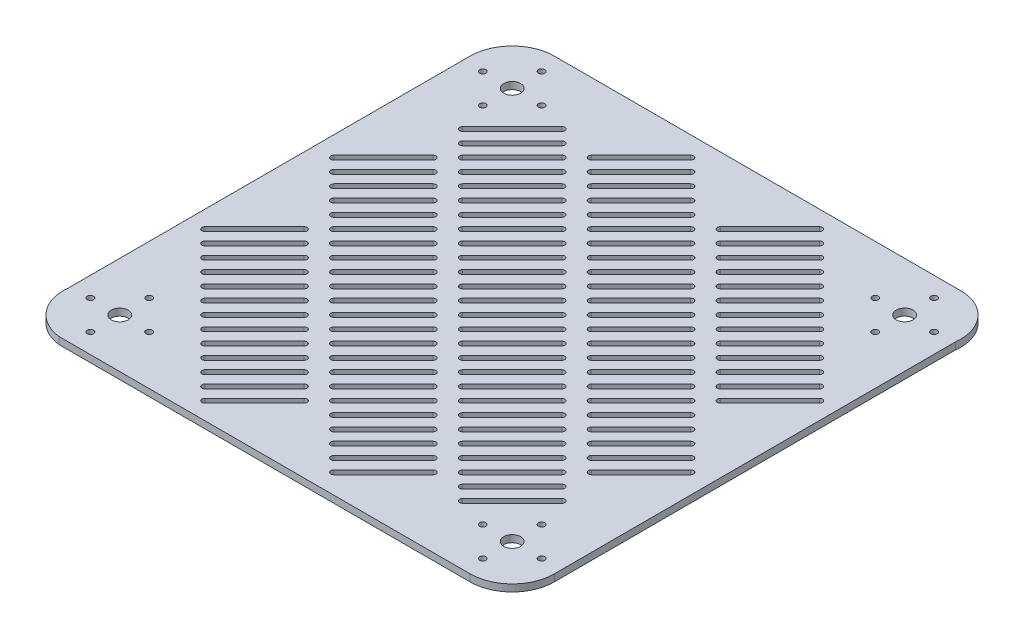
from build123d import *

# Parameters (mm, degrees)
SKETCH_5_R      = 2.25
SKETCH_5_R_2    = 6.02
EXTRUDE_2_DEPTH = 5


with BuildPart() as part:
    # 草图5 → 凸台-拉伸2 (new body)
    with BuildSketch(Plane(origin=(0, 0, 0), x_dir=(1, 0, 0), z_dir=(0, 1, 0))):
        with BuildLine():
            Line((-145, 175.000139282), (144.999922622, 175.000139282))
            ThreePointArc((144.999922622, 175.000139282), (167.429032222, 164.92347758), (174.790880658, 141.462717658))
            Line((174.790880658, 141.462717658), (175.000123274, -144.97808516))
            ThreePointArc((175.000123274, -144.97808516), (166.221042914, -166.205546782), (145, -175.000139282))
            Line((145, -175.000139282), (-148.46080939, -175.000139282))
            ThreePointArc((-148.46080939, -175.000139282), (-168.660495762, -163.766062757), (-175.000139282, -141.539035853))
            Line((-175.000139282, -141.539035853), (-175.000139282, 145))
            ThreePointArc((-175.000139282, 145), (-166.213301923, 166.213301923), (-145, 175.000139282))
        make_face()
        with Locations(Location((140, 119, 0), (0, 0, 270))):
            Circle(SKETCH_5_R, mode=Mode.SUBTRACT)
        with Locations(Location((161, 140, 0), (0, 0, 270))):
            Circle(SKETCH_5_R, mode=Mode.SUBTRACT)
        with Locations(Location((140, 161, 0), (0, 0, 270))):
            Circle(SKETCH_5_R, mode=Mode.SUBTRACT)
        with Locations(Location((119, 140, 0), (0, 0, 270))):
            Circle(SKETCH_5_R, mode=Mode.SUBTRACT)
        with Locations(Location((140, 140, 0), (0, 0, 270))):
            Circle(SKETCH_5_R_2, mode=Mode.SUBTRACT)
        with Locations(Location((140, -161, 0), (0, 0, 270))):
            Circle(SKETCH_5_R, mode=Mode.SUBTRACT)
        with Locations(Location((161, -140, 0), (0, 0, 270))):
            Circle(SKETCH_5_R, mode=Mode.SUBTRACT)
        with Locations(Location((140, -119, 0), (0, 0, 270))):
            Circle(SKETCH_5_R, mode=Mode.SUBTRACT)
        with Locations(Location((119, -140, 0), (0, 0, 270))):
            Circle(SKETCH_5_R, mode=Mode.SUBTRACT)
        with Locations(Location((140, -140, 0), (0, 0, 270))):
            Circle(SKETCH_5_R_2, mode=Mode.SUBTRACT)
        with Locations(Location((-140, 119, 0), (0, 0, 270))):
            Circle(SKETCH_5_R, mode=Mode.SUBTRACT)
        with Locations(Location((-119, 140, 0), (0, 0, 270))):
            Circle(SKETCH_5_R, mode=Mode.SUBTRACT)
        with Locations(Location((-140, 161, 0), (0, 0, 270))):
            Circle(SKETCH_5_R, mode=Mode.SUBTRACT)
        with Locations(Location((-161, 140, 0), (0, 0, 270))):
            Circle(SKETCH_5_R, mode=Mode.SUBTRACT)
        with Locations(Location((-140, 140, 0), (0, 0, 270))):
            Circle(SKETCH_5_R_2, mode=Mode.SUBTRACT)
        with Locations(Location((-140, -161, 0), (0, 0, 270))):
            Circle(SKETCH_5_R, mode=Mode.SUBTRACT)
        with Locations(Location((-119, -140.040540979, 0), (0, 0, 270))):
            Circle(SKETCH_5_R, mode=Mode.SUBTRACT)
        with Locations(Location((-140, -119, 0), (0, 0, 270))):
            Circle(SKETCH_5_R, mode=Mode.SUBTRACT)
        with Locations(Location((-161, -139.999994927, 0), (0, 0, 270))):
            Circle(SKETCH_5_R, mode=Mode.SUBTRACT)
        with Locations(Location((-140, -140.040540979, 0), (0, 0, 270))):
            Circle(SKETCH_5_R_2, mode=Mode.SUBTRACT)
        with BuildLine():
            Line((-28.041433375, -7.313905684), (7.313905684, 28.041433375))
            ThreePointArc((7.313905684, 28.041433375), (10.363763845, 28.041433375), (10.363763845, 24.991575214))
            Line((10.363763845, 24.991575214), (-24.991575214, -10.363763845))
            ThreePointArc((-24.991575214, -10.363763845), (-28.041433375, -10.363763845), (-28.041433375, -7.313905684))
        make_face(mode=Mode.SUBTRACT)
        with BuildLine():
            Line((-36.88026814, 1.524929081), (-1.524929081, 36.88026814))
            ThreePointArc((-1.524929081, 36.88026814), (1.524929081, 36.88026814), (1.524929081, 33.830409979))
            Line((1.524929081, 33.830409979), (-33.830409979, -1.524929081))
            ThreePointArc((-33.830409979, -1.524929081), (-36.88026814, -1.524929081), (-36.88026814, 1.524929081))
        make_face(mode=Mode.SUBTRACT)
        with BuildLine():
            Line((-45.719102905, 10.363763845), (-10.363763845, 45.719102905))
            ThreePointArc((-10.363763845, 45.719102905), (-7.313905684, 45.719102905), (-7.313905684, 42.669244744))
            Line((-7.313905684, 42.669244744), (-42.669244744, 7.313905684))
            ThreePointArc((-42.669244744, 7.313905684), (-45.719102905, 7.313905684), (-45.719102905, 10.363763845))
        make_face(mode=Mode.SUBTRACT)
        with BuildLine():
            Line((-54.55793767, 19.20259861), (-19.20259861, 54.55793767))
            ThreePointArc((-19.20259861, 54.55793767), (-16.152740449, 54.55793767), (-16.152740449, 51.508079508))
            Line((-16.152740449, 51.508079508), (-51.508079508, 16.152740449))
            ThreePointArc((-51.508079508, 16.152740449), (-54.55793767, 16.152740449), (-54.55793767, 19.20259861))
        make_face(mode=Mode.SUBTRACT)
        with BuildLine():
            Line((-63.396772434, 28.041433375), (-28.041433375, 63.396772434))
            ThreePointArc((-28.041433375, 63.396772434), (-24.991575214, 63.396772434), (-24.991575214, 60.346914273))
            Line((-24.991575214, 60.346914273), (-60.346914273, 24.991575214))
            ThreePointArc((-60.346914273, 24.991575214), (-63.396772434, 24.991575214), (-63.396772434, 28.041433375))
        make_face(mode=Mode.SUBTRACT)
        with BuildLine():
            Line((-72.235607199, 36.88026814), (-36.88026814, 72.235607199))
            ThreePointArc((-36.88026814, 72.235607199), (-33.830409979, 72.235607199), (-33.830409979, 69.185749038))
            Line((-33.830409979, 69.185749038), (-69.185749038, 33.830409979))
            ThreePointArc((-69.185749038, 33.830409979), (-72.235607199, 33.830409979), (-72.235607199, 36.88026814))
        make_face(mode=Mode.SUBTRACT)
        with BuildLine():
            Line((-81.074441964, 45.719102905), (-45.719102905, 81.074441964))
            ThreePointArc((-45.719102905, 81.074441964), (-42.669244744, 81.074441964), (-42.669244744, 78.024583803))
            Line((-42.669244744, 78.024583803), (-78.024583803, 42.669244744))
            ThreePointArc((-78.024583803, 42.669244744), (-81.074441964, 42.669244744), (-81.074441964, 45.719102905))
        make_face(mode=Mode.SUBTRACT)
        with BuildLine():
            Line((-19.20259861, -16.152740449), (16.152740449, 19.20259861))
            ThreePointArc((16.152740449, 19.20259861), (19.20259861, 19.20259861), (19.20259861, 16.152740449))
            Line((19.20259861, 16.152740449), (-16.152740449, -19.20259861))
            ThreePointArc((-16.152740449, -19.20259861), (-19.20259861, -19.20259861), (-19.20259861, -16.152740449))
        make_face(mode=Mode.SUBTRACT)
        with BuildLine():
            Line((-89.913276729, 54.55793767), (-54.55793767, 89.913276729))
            ThreePointArc((-54.55793767, 89.913276729), (-51.508079508, 89.913276729), (-51.508079508, 86.863418568))
            Line((-51.508079508, 86.863418568), (-86.863418568, 51.508079508))
            ThreePointArc((-86.863418568, 51.508079508), (-89.913276729, 51.508079508), (-89.913276729, 54.55793767))
        make_face(mode=Mode.SUBTRACT)
        with BuildLine():
            Line((-98.752111494, 63.396772434), (-63.396772434, 98.752111494))
            ThreePointArc((-63.396772434, 98.752111494), (-60.346914273, 98.752111494), (-60.346914273, 95.702253333))
            Line((-60.346914273, 95.702253333), (-95.702253333, 60.346914273))
            ThreePointArc((-95.702253333, 60.346914273), (-98.752111494, 60.346914273), (-98.752111494, 63.396772434))
        make_face(mode=Mode.SUBTRACT)
        with BuildLine():
            Line((-107.590946259, 72.235607199), (-72.235607199, 107.590946259))
            ThreePointArc((-72.235607199, 107.590946259), (-69.185749038, 107.590946259), (-69.185749038, 104.541088097))
            Line((-69.185749038, 104.541088097), (-104.541088097, 69.185749038))
            ThreePointArc((-104.541088097, 69.185749038), (-107.590946259, 69.185749038), (-107.590946259, 72.235607199))
        make_face(mode=Mode.SUBTRACT)
        with BuildLine():
            Line((-116.429781023, 81.074441964), (-81.074441964, 116.429781023))
            ThreePointArc((-81.074441964, 116.429781023), (-78.024583803, 116.429781023), (-78.024583803, 113.379922862))
            Line((-78.024583803, 113.379922862), (-113.379922862, 78.024583803))
            ThreePointArc((-113.379922862, 78.024583803), (-116.429781023, 78.024583803), (-116.429781023, 81.074441964))
        make_face(mode=Mode.SUBTRACT)
        with BuildLine():
            Line((-125.268615788, 89.913276729), (-89.913276729, 125.268615788))
            ThreePointArc((-89.913276729, 125.268615788), (-86.863418568, 125.268615788), (-86.863418568, 122.218757627))
            Line((-86.863418568, 122.218757627), (-122.218757627, 86.863418568))
            ThreePointArc((-122.218757627, 86.863418568), (-125.268615788, 86.863418568), (-125.268615788, 89.913276729))
        make_face(mode=Mode.SUBTRACT)
        with BuildLine():
            Line((-134.107450553, 98.752111494), (-98.752111494, 134.107450553))
            ThreePointArc((-98.752111494, 134.107450553), (-95.702253333, 134.107450553), (-95.702253333, 131.057592392))
            Line((-95.702253333, 131.057592392), (-131.057592392, 95.702253333))
            ThreePointArc((-131.057592392, 95.702253333), (-134.107450553, 95.702253333), (-134.107450553, 98.752111494))
        make_face(mode=Mode.SUBTRACT)
        with BuildLine():
            Line((-10.363763845, -24.991575214), (24.991575214, 10.363763845))
            ThreePointArc((24.991575214, 10.363763845), (28.041433375, 10.363763845), (28.041433375, 7.313905684))
            Line((28.041433375, 7.313905684), (-7.313905684, -28.041433375))
            ThreePointArc((-7.313905684, -28.041433375), (-10.363763845, -28.041433375), (-10.363763845, -24.991575214))
        make_face(mode=Mode.SUBTRACT)
        with BuildLine():
            Line((-1.524929081, -33.830409979), (33.830409979, 1.524929081))
            ThreePointArc((33.830409979, 1.524929081), (36.88026814, 1.524929081), (36.88026814, -1.524929081))
            Line((36.88026814, -1.524929081), (1.524929081, -36.88026814))
            ThreePointArc((1.524929081, -36.88026814), (-1.524929081, -36.88026814), (-1.524929081, -33.830409979))
        make_face(mode=Mode.SUBTRACT)
        with BuildLine():
            Line((7.313905684, -42.669244744), (42.669244744, -7.313905684))
            ThreePointArc((42.669244744, -7.313905684), (45.719102905, -7.313905684), (45.719102905, -10.363763845))
            Line((45.719102905, -10.363763845), (10.363763845, -45.719102905))
            ThreePointArc((10.363763845, -45.719102905), (7.313905684, -45.719102905), (7.313905684, -42.669244744))
        make_face(mode=Mode.SUBTRACT)
        with BuildLine():
            Line((16.152740449, -51.508079508), (51.508079508, -16.152740449))
            ThreePointArc((51.508079508, -16.152740449), (54.55793767, -16.152740449), (54.55793767, -19.20259861))
            Line((54.55793767, -19.20259861), (19.20259861, -54.55793767))
            ThreePointArc((19.20259861, -54.55793767), (16.152740449, -54.55793767), (16.152740449, -51.508079508))
        make_face(mode=Mode.SUBTRACT)
        with BuildLine():
            Line((24.991575214, -60.346914273), (60.346914273, -24.991575214))
            ThreePointArc((60.346914273, -24.991575214), (63.396772434, -24.991575214), (63.396772434, -28.041433375))
            Line((63.396772434, -28.041433375), (28.041433375, -63.396772434))
            ThreePointArc((28.041433375, -63.396772434), (24.991575214, -63.396772434), (24.991575214, -60.346914273))
        make_face(mode=Mode.SUBTRACT)
        with BuildLine():
            Line((33.830409979, -69.185749038), (69.185749038, -33.830409979))
            ThreePointArc((69.185749038, -33.830409979), (72.235607199, -33.830409979), (72.235607199, -36.88026814))
            Line((72.235607199, -36.88026814), (36.88026814, -72.235607199))
            ThreePointArc((36.88026814, -72.235607199), (33.830409979, -72.235607199), (33.830409979, -69.185749038))
        make_face(mode=Mode.SUBTRACT)
        with BuildLine():
            Line((42.669244744, -78.024583803), (78.024583803, -42.669244744))
            ThreePointArc((78.024583803, -42.669244744), (81.074441964, -42.669244744), (81.074441964, -45.719102905))
            Line((81.074441964, -45.719102905), (45.719102905, -81.074441964))
            ThreePointArc((45.719102905, -81.074441964), (42.669244744, -81.074441964), (42.669244744, -78.024583803))
        make_face(mode=Mode.SUBTRACT)
        with BuildLine():
            Line((51.508079508, -86.863418568), (86.863418568, -51.508079508))
            ThreePointArc((86.863418568, -51.508079508), (89.913276729, -51.508079508), (89.913276729, -54.55793767))
            Line((89.913276729, -54.55793767), (54.55793767, -89.913276729))
            ThreePointArc((54.55793767, -89.913276729), (51.508079508, -89.913276729), (51.508079508, -86.863418568))
        make_face(mode=Mode.SUBTRACT)
        with BuildLine():
            Line((60.346914273, -95.702253333), (95.702253333, -60.346914273))
            ThreePointArc((95.702253333, -60.346914273), (98.752111494, -60.346914273), (98.752111494, -63.396772434))
            Line((98.752111494, -63.396772434), (63.396772434, -98.752111494))
            ThreePointArc((63.396772434, -98.752111494), (60.346914273, -98.752111494), (60.346914273, -95.702253333))
        make_face(mode=Mode.SUBTRACT)
        with BuildLine():
            Line((69.185749038, -104.541088097), (104.541088097, -69.185749038))
            ThreePointArc((104.541088097, -69.185749038), (107.590946259, -69.185749038), (107.590946259, -72.235607199))
            Line((107.590946259, -72.235607199), (72.235607199, -107.590946259))
            ThreePointArc((72.235607199, -107.590946259), (69.185749038, -107.590946259), (69.185749038, -104.541088097))
        make_face(mode=Mode.SUBTRACT)
        with BuildLine():
            Line((78.024583803, -113.379922862), (113.379922862, -78.024583803))
            ThreePointArc((113.379922862, -78.024583803), (116.429781023, -78.024583803), (116.429781023, -81.074441964))
            Line((116.429781023, -81.074441964), (81.074441964, -116.429781023))
            ThreePointArc((81.074441964, -116.429781023), (78.024583803, -116.429781023), (78.024583803, -113.379922862))
        make_face(mode=Mode.SUBTRACT)
        with BuildLine():
            Line((86.863418568, -122.218757627), (122.218757627, -86.863418568))
            ThreePointArc((122.218757627, -86.863418568), (125.268615788, -86.863418568), (125.268615788, -89.913276729))
            Line((125.268615788, -89.913276729), (89.913276729, -125.268615788))
            ThreePointArc((89.913276729, -125.268615788), (86.863418568, -125.268615788), (86.863418568, -122.218757627))
        make_face(mode=Mode.SUBTRACT)
        with BuildLine():
            Line((95.702253333, -131.057592392), (131.057592392, -95.702253333))
            ThreePointArc((131.057592392, -95.702253333), (134.107450553, -95.702253333), (134.107450553, -98.752111494))
            Line((134.107450553, -98.752111494), (98.752111494, -134.107450553))
            ThreePointArc((98.752111494, -134.107450553), (95.702253333, -134.107450553), (95.702253333, -131.057592392))
        make_face(mode=Mode.SUBTRACT)
        with BuildLine():
            Line((26.759342167, 29.809200328), (62.114681226, 65.164539387))
            ThreePointArc((62.114681226, 65.164539387), (65.164539387, 65.164539387), (65.164539387, 62.114681226))
            Line((65.164539387, 62.114681226), (29.809200328, 26.759342167))
            ThreePointArc((29.809200328, 26.759342167), (26.759342167, 26.759342167), (26.759342167, 29.809200328))
        make_face(mode=Mode.SUBTRACT)
        with BuildLine():
            Line((72.721282944, 75.771141105), (108.076622003, 111.126480165))
            ThreePointArc((108.076622003, 111.126480165), (111.126480165, 111.126480165), (111.126480165, 108.076622003))
            Line((111.126480165, 108.076622003), (75.771141105, 72.721282944))
            ThreePointArc((75.771141105, 72.721282944), (72.721282944, 72.721282944), (72.721282944, 75.771141105))
        make_face(mode=Mode.SUBTRACT)
        with BuildLine():
            Line((17.920507402, 38.648035093), (53.275846461, 74.003374152))
            ThreePointArc((53.275846461, 74.003374152), (56.325704623, 74.003374152), (56.325704623, 70.953515991))
            Line((56.325704623, 70.953515991), (20.970365563, 35.598176932))
            ThreePointArc((20.970365563, 35.598176932), (17.920507402, 35.598176932), (17.920507402, 38.648035093))
        make_face(mode=Mode.SUBTRACT)
        with BuildLine():
            Line((9.081672637, 47.486869858), (44.437011696, 82.842208917))
            ThreePointArc((44.437011696, 82.842208917), (47.486869858, 82.842208917), (47.486869858, 79.792350756))
            Line((47.486869858, 79.792350756), (12.131530798, 44.437011696))
            ThreePointArc((12.131530798, 44.437011696), (9.081672637, 44.437011696), (9.081672637, 47.486869858))
        make_face(mode=Mode.SUBTRACT)
        with BuildLine():
            Line((0.242837872, 56.325704623), (35.598176932, 91.681043682))
            ThreePointArc((35.598176932, 91.681043682), (38.648035093, 91.681043682), (38.648035093, 88.631185521))
            Line((38.648035093, 88.631185521), (3.292696034, 53.275846461))
            ThreePointArc((3.292696034, 53.275846461), (0.242837872, 53.275846461), (0.242837872, 56.325704623))
        make_face(mode=Mode.SUBTRACT)
        with BuildLine():
            Line((-8.595996893, 65.164539387), (26.759342167, 100.519878447))
            ThreePointArc((26.759342167, 100.519878447), (29.809200328, 100.519878447), (29.809200328, 97.470020285))
            Line((29.809200328, 97.470020285), (-5.546138731, 62.114681226))
            ThreePointArc((-5.546138731, 62.114681226), (-8.595996893, 62.114681226), (-8.595996893, 65.164539387))
        make_face(mode=Mode.SUBTRACT)
        with BuildLine():
            Line((-17.434831657, 74.003374152), (17.920507402, 109.358713212))
            ThreePointArc((17.920507402, 109.358713212), (20.970365563, 109.358713212), (20.970365563, 106.30885505))
            Line((20.970365563, 106.30885505), (-14.384973496, 70.953515991))
            ThreePointArc((-14.384973496, 70.953515991), (-17.434831657, 70.953515991), (-17.434831657, 74.003374152))
        make_face(mode=Mode.SUBTRACT)
        with BuildLine():
            Line((-26.273666422, 82.842208917), (9.081672637, 118.197547976))
            ThreePointArc((9.081672637, 118.197547976), (12.131530798, 118.197547976), (12.131530798, 115.147689815))
            Line((12.131530798, 115.147689815), (-23.223808261, 79.792350756))
            ThreePointArc((-23.223808261, 79.792350756), (-26.273666422, 79.792350756), (-26.273666422, 82.842208917))
        make_face(mode=Mode.SUBTRACT)
        with BuildLine():
            Line((-35.112501187, 91.681043682), (0.242837872, 127.036382741))
            ThreePointArc((0.242837872, 127.036382741), (3.292696034, 127.036382741), (3.292696034, 123.98652458))
            Line((3.292696034, 123.98652458), (-32.062643026, 88.631185521))
            ThreePointArc((-32.062643026, 88.631185521), (-35.112501187, 88.631185521), (-35.112501187, 91.681043682))
        make_face(mode=Mode.SUBTRACT)
        with BuildLine():
            Line((-43.951335952, 100.519878447), (-8.595996893, 135.875217506))
            ThreePointArc((-8.595996893, 135.875217506), (-5.546138731, 135.875217506), (-5.546138731, 132.825359345))
            Line((-5.546138731, 132.825359345), (-40.901477791, 97.470020285))
            ThreePointArc((-40.901477791, 97.470020285), (-43.951335952, 97.470020285), (-43.951335952, 100.519878447))
        make_face(mode=Mode.SUBTRACT)
        with BuildLine():
            Line((-52.790170717, 109.358713212), (-17.434831657, 144.714052271))
            ThreePointArc((-17.434831657, 144.714052271), (-14.384973496, 144.714052271), (-14.384973496, 141.66419411))
            Line((-14.384973496, 141.66419411), (-49.740312555, 106.30885505))
            ThreePointArc((-49.740312555, 106.30885505), (-52.790170717, 106.30885505), (-52.790170717, 109.358713212))
        make_face(mode=Mode.SUBTRACT)
        with BuildLine():
            Line((-61.629005481, 118.197547976), (-26.273666422, 153.552887036))
            ThreePointArc((-26.273666422, 153.552887036), (-23.223808261, 153.552887036), (-23.223808261, 150.503028874))
            Line((-23.223808261, 150.503028874), (-58.57914732, 115.147689815))
            ThreePointArc((-58.57914732, 115.147689815), (-61.629005481, 115.147689815), (-61.629005481, 118.197547976))
        make_face(mode=Mode.SUBTRACT)
        with BuildLine():
            Line((-70.467840246, 127.036382741), (-35.112501187, 162.391721801))
            ThreePointArc((-35.112501187, 162.391721801), (-32.062643026, 162.391721801), (-32.062643026, 159.341863639))
            Line((-32.062643026, 159.341863639), (-67.417982085, 123.98652458))
            ThreePointArc((-67.417982085, 123.98652458), (-70.467840246, 123.98652458), (-70.467840246, 127.036382741))
        make_face(mode=Mode.SUBTRACT)
        with BuildLine():
            Line((35.598176932, 20.970365563), (70.953515991, 56.325704623))
            ThreePointArc((70.953515991, 56.325704623), (74.003374152, 56.325704623), (74.003374152, 53.275846461))
            Line((74.003374152, 53.275846461), (38.648035093, 17.920507402))
            ThreePointArc((38.648035093, 17.920507402), (35.598176932, 17.920507402), (35.598176932, 20.970365563))
        make_face(mode=Mode.SUBTRACT)
        with BuildLine():
            Line((44.437011696, 12.131530798), (79.792350756, 47.486869858))
            ThreePointArc((79.792350756, 47.486869858), (82.842208917, 47.486869858), (82.842208917, 44.437011696))
            Line((82.842208917, 44.437011696), (47.486869858, 9.081672637))
            ThreePointArc((47.486869858, 9.081672637), (44.437011696, 9.081672637), (44.437011696, 12.131530798))
        make_face(mode=Mode.SUBTRACT)
        with BuildLine():
            Line((53.275846461, 3.292696034), (88.631185521, 38.648035093))
            ThreePointArc((88.631185521, 38.648035093), (91.681043682, 38.648035093), (91.681043682, 35.598176932))
            Line((91.681043682, 35.598176932), (56.325704623, 0.242837872))
            ThreePointArc((56.325704623, 0.242837872), (53.275846461, 0.242837872), (53.275846461, 3.292696034))
        make_face(mode=Mode.SUBTRACT)
        with BuildLine():
            Line((62.114681226, -5.546138731), (97.470020285, 29.809200328))
            ThreePointArc((97.470020285, 29.809200328), (100.519878447, 29.809200328), (100.519878447, 26.759342167))
            Line((100.519878447, 26.759342167), (65.164539387, -8.595996893))
            ThreePointArc((65.164539387, -8.595996893), (62.114681226, -8.595996893), (62.114681226, -5.546138731))
        make_face(mode=Mode.SUBTRACT)
        with BuildLine():
            Line((70.953515991, -14.384973496), (106.30885505, 20.970365563))
            ThreePointArc((106.30885505, 20.970365563), (109.358713212, 20.970365563), (109.358713212, 17.920507402))
            Line((109.358713212, 17.920507402), (74.003374152, -17.434831657))
            ThreePointArc((74.003374152, -17.434831657), (70.953515991, -17.434831657), (70.953515991, -14.384973496))
        make_face(mode=Mode.SUBTRACT)
        with BuildLine():
            Line((79.792350756, -23.223808261), (115.147689815, 12.131530798))
            ThreePointArc((115.147689815, 12.131530798), (118.197547976, 12.131530798), (118.197547976, 9.081672637))
            Line((118.197547976, 9.081672637), (82.842208917, -26.273666422))
            ThreePointArc((82.842208917, -26.273666422), (79.792350756, -26.273666422), (79.792350756, -23.223808261))
        make_face(mode=Mode.SUBTRACT)
        with BuildLine():
            Line((88.631185521, -32.062643026), (123.98652458, 3.292696034))
            ThreePointArc((123.98652458, 3.292696034), (127.036382741, 3.292696034), (127.036382741, 0.242837872))
            Line((127.036382741, 0.242837872), (91.681043682, -35.112501187))
            ThreePointArc((91.681043682, -35.112501187), (88.631185521, -35.112501187), (88.631185521, -32.062643026))
        make_face(mode=Mode.SUBTRACT)
        with BuildLine():
            Line((97.470020285, -40.901477791), (132.825359345, -5.546138731))
            ThreePointArc((132.825359345, -5.546138731), (135.875217506, -5.546138731), (135.875217506, -8.595996893))
            Line((135.875217506, -8.595996893), (100.519878447, -43.951335952))
            ThreePointArc((100.519878447, -43.951335952), (97.470020285, -43.951335952), (97.470020285, -40.901477791))
        make_face(mode=Mode.SUBTRACT)
        with BuildLine():
            Line((106.30885505, -49.740312555), (141.66419411, -14.384973496))
            ThreePointArc((141.66419411, -14.384973496), (144.714052271, -14.384973496), (144.714052271, -17.434831657))
            Line((144.714052271, -17.434831657), (109.358713212, -52.790170717))
            ThreePointArc((109.358713212, -52.790170717), (106.30885505, -52.790170717), (106.30885505, -49.740312555))
        make_face(mode=Mode.SUBTRACT)
        with BuildLine():
            Line((115.147689815, -58.57914732), (150.503028874, -23.223808261))
            ThreePointArc((150.503028874, -23.223808261), (153.552887036, -23.223808261), (153.552887036, -26.273666422))
            Line((153.552887036, -26.273666422), (118.197547976, -61.629005481))
            ThreePointArc((118.197547976, -61.629005481), (115.147689815, -61.629005481), (115.147689815, -58.57914732))
        make_face(mode=Mode.SUBTRACT)
        with BuildLine():
            Line((123.98652458, -67.417982085), (159.341863639, -32.062643026))
            ThreePointArc((159.341863639, -32.062643026), (162.391721801, -32.062643026), (162.391721801, -35.112501187))
            Line((162.391721801, -35.112501187), (127.036382741, -70.467840246))
            ThreePointArc((127.036382741, -70.467840246), (123.98652458, -70.467840246), (123.98652458, -67.417982085))
        make_face(mode=Mode.SUBTRACT)
        with BuildLine():
            Line((63.882448179, 84.60997587), (99.237787238, 119.965314929))
            ThreePointArc((99.237787238, 119.965314929), (102.2876454, 119.965314929), (102.2876454, 116.915456768))
            Line((102.2876454, 116.915456768), (66.93230634, 81.560117709))
            ThreePointArc((66.93230634, 81.560117709), (63.882448179, 81.560117709), (63.882448179, 84.60997587))
        make_face(mode=Mode.SUBTRACT)
        with BuildLine():
            Line((55.043613414, 93.448810635), (90.398952474, 128.804149694))
            ThreePointArc((90.398952474, 128.804149694), (93.448810635, 128.804149694), (93.448810635, 125.754291533))
            Line((93.448810635, 125.754291533), (58.093471576, 90.398952474))
            ThreePointArc((58.093471576, 90.398952474), (55.043613414, 90.398952474), (55.043613414, 93.448810635))
        make_face(mode=Mode.SUBTRACT)
        with BuildLine():
            Line((46.204778649, 102.2876454), (81.560117709, 137.642984459))
            ThreePointArc((81.560117709, 137.642984459), (84.60997587, 137.642984459), (84.60997587, 134.593126298))
            Line((84.60997587, 134.593126298), (49.254636811, 99.237787238))
            ThreePointArc((49.254636811, 99.237787238), (46.204778649, 99.237787238), (46.204778649, 102.2876454))
        make_face(mode=Mode.SUBTRACT)
        with BuildLine():
            Line((37.365943885, 111.126480165), (72.721282944, 146.481819224))
            ThreePointArc((72.721282944, 146.481819224), (75.771141105, 146.481819224), (75.771141105, 143.431961063))
            Line((75.771141105, 143.431961063), (40.415802046, 108.076622003))
            ThreePointArc((40.415802046, 108.076622003), (37.365943885, 108.076622003), (37.365943885, 111.126480165))
        make_face(mode=Mode.SUBTRACT)
        with BuildLine():
            Line((28.52710912, 119.965314929), (63.882448179, 155.320653989))
            ThreePointArc((63.882448179, 155.320653989), (66.93230634, 155.320653989), (66.93230634, 152.270795827))
            Line((66.93230634, 152.270795827), (31.576967281, 116.915456768))
            ThreePointArc((31.576967281, 116.915456768), (28.52710912, 116.915456768), (28.52710912, 119.965314929))
        make_face(mode=Mode.SUBTRACT)
        with BuildLine():
            Line((19.688274355, 128.804149694), (55.043613414, 164.159488754))
            ThreePointArc((55.043613414, 164.159488754), (58.093471576, 164.159488754), (58.093471576, 161.109630592))
            Line((58.093471576, 161.109630592), (22.738132516, 125.754291533))
            ThreePointArc((22.738132516, 125.754291533), (19.688274355, 125.754291533), (19.688274355, 128.804149694))
        make_face(mode=Mode.SUBTRACT)
        with BuildLine():
            Line((81.560117709, 66.93230634), (116.915456768, 102.2876454))
            ThreePointArc((116.915456768, 102.2876454), (119.965314929, 102.2876454), (119.965314929, 99.237787238))
            Line((119.965314929, 99.237787238), (84.60997587, 63.882448179))
            ThreePointArc((84.60997587, 63.882448179), (81.560117709, 63.882448179), (81.560117709, 66.93230634))
        make_face(mode=Mode.SUBTRACT)
        with BuildLine():
            Line((90.398952474, 58.093471576), (125.754291533, 93.448810635))
            ThreePointArc((125.754291533, 93.448810635), (128.804149694, 93.448810635), (128.804149694, 90.398952474))
            Line((128.804149694, 90.398952474), (93.448810635, 55.043613414))
            ThreePointArc((93.448810635, 55.043613414), (90.398952474, 55.043613414), (90.398952474, 58.093471576))
        make_face(mode=Mode.SUBTRACT)
        with BuildLine():
            Line((99.237787238, 49.254636811), (134.593126298, 84.60997587))
            ThreePointArc((134.593126298, 84.60997587), (137.642984459, 84.60997587), (137.642984459, 81.560117709))
            Line((137.642984459, 81.560117709), (102.2876454, 46.204778649))
            ThreePointArc((102.2876454, 46.204778649), (99.237787238, 46.204778649), (99.237787238, 49.254636811))
        make_face(mode=Mode.SUBTRACT)
        with BuildLine():
            Line((108.076622003, 40.415802046), (143.431961063, 75.771141105))
            ThreePointArc((143.431961063, 75.771141105), (146.481819224, 75.771141105), (146.481819224, 72.721282944))
            Line((146.481819224, 72.721282944), (111.126480165, 37.365943885))
            ThreePointArc((111.126480165, 37.365943885), (108.076622003, 37.365943885), (108.076622003, 40.415802046))
        make_face(mode=Mode.SUBTRACT)
        with BuildLine():
            Line((116.915456768, 31.576967281), (152.270795827, 66.93230634))
            ThreePointArc((152.270795827, 66.93230634), (155.320653989, 66.93230634), (155.320653989, 63.882448179))
            Line((155.320653989, 63.882448179), (119.965314929, 28.52710912))
            ThreePointArc((119.965314929, 28.52710912), (116.915456768, 28.52710912), (116.915456768, 31.576967281))
        make_face(mode=Mode.SUBTRACT)
        with BuildLine():
            Line((125.754291533, 22.738132516), (161.109630592, 58.093471576))
            ThreePointArc((161.109630592, 58.093471576), (164.159488754, 58.093471576), (164.159488754, 55.043613414))
            Line((164.159488754, 55.043613414), (128.804149694, 19.688274355))
            ThreePointArc((128.804149694, 19.688274355), (125.754291533, 19.688274355), (125.754291533, 22.738132516))
        make_face(mode=Mode.SUBTRACT)
        with BuildLine():
            Line((-65.164539387, -62.114681226), (-29.809200328, -26.759342167))
            ThreePointArc((-29.809200328, -26.759342167), (-26.759342167, -26.759342167), (-26.759342167, -29.809200328))
            Line((-26.759342167, -29.809200328), (-62.114681226, -65.164539387))
            ThreePointArc((-62.114681226, -65.164539387), (-65.164539387, -65.164539387), (-65.164539387, -62.114681226))
        make_face(mode=Mode.SUBTRACT)
        with BuildLine():
            Line((-111.126480165, -108.076622003), (-75.771141105, -72.721282944))
            ThreePointArc((-75.771141105, -72.721282944), (-72.721282944, -72.721282944), (-72.721282944, -75.771141105))
            Line((-72.721282944, -75.771141105), (-108.076622003, -111.126480165))
            ThreePointArc((-108.076622003, -111.126480165), (-111.126480165, -111.126480165), (-111.126480165, -108.076622003))
        make_face(mode=Mode.SUBTRACT)
        with BuildLine():
            Line((-74.003374152, -53.275846461), (-38.648035093, -17.920507402))
            ThreePointArc((-38.648035093, -17.920507402), (-35.598176932, -17.920507402), (-35.598176932, -20.970365563))
            Line((-35.598176932, -20.970365563), (-70.953515991, -56.325704623))
            ThreePointArc((-70.953515991, -56.325704623), (-74.003374152, -56.325704623), (-74.003374152, -53.275846461))
        make_face(mode=Mode.SUBTRACT)
        with BuildLine():
            Line((-82.842208917, -44.437011696), (-47.486869858, -9.081672637))
            ThreePointArc((-47.486869858, -9.081672637), (-44.437011696, -9.081672637), (-44.437011696, -12.131530798))
            Line((-44.437011696, -12.131530798), (-79.792350756, -47.486869858))
            ThreePointArc((-79.792350756, -47.486869858), (-82.842208917, -47.486869858), (-82.842208917, -44.437011696))
        make_face(mode=Mode.SUBTRACT)
        with BuildLine():
            Line((-91.681043682, -35.598176932), (-56.325704623, -0.242837872))
            ThreePointArc((-56.325704623, -0.242837872), (-53.275846461, -0.242837872), (-53.275846461, -3.292696034))
            Line((-53.275846461, -3.292696034), (-88.631185521, -38.648035093))
            ThreePointArc((-88.631185521, -38.648035093), (-91.681043682, -38.648035093), (-91.681043682, -35.598176932))
        make_face(mode=Mode.SUBTRACT)
        with BuildLine():
            Line((-100.519878447, -26.759342167), (-65.164539387, 8.595996893))
            ThreePointArc((-65.164539387, 8.595996893), (-62.114681226, 8.595996893), (-62.114681226, 5.546138731))
            Line((-62.114681226, 5.546138731), (-97.470020285, -29.809200328))
            ThreePointArc((-97.470020285, -29.809200328), (-100.519878447, -29.809200328), (-100.519878447, -26.759342167))
        make_face(mode=Mode.SUBTRACT)
        with BuildLine():
            Line((-109.358713212, -17.920507402), (-74.003374152, 17.434831657))
            ThreePointArc((-74.003374152, 17.434831657), (-70.953515991, 17.434831657), (-70.953515991, 14.384973496))
            Line((-70.953515991, 14.384973496), (-106.30885505, -20.970365563))
            ThreePointArc((-106.30885505, -20.970365563), (-109.358713212, -20.970365563), (-109.358713212, -17.920507402))
        make_face(mode=Mode.SUBTRACT)
        with BuildLine():
            Line((-118.197547976, -9.081672637), (-82.842208917, 26.273666422))
            ThreePointArc((-82.842208917, 26.273666422), (-79.792350756, 26.273666422), (-79.792350756, 23.223808261))
            Line((-79.792350756, 23.223808261), (-115.147689815, -12.131530798))
            ThreePointArc((-115.147689815, -12.131530798), (-118.197547976, -12.131530798), (-118.197547976, -9.081672637))
        make_face(mode=Mode.SUBTRACT)
        with BuildLine():
            Line((-127.036382741, -0.242837872), (-91.681043682, 35.112501187))
            ThreePointArc((-91.681043682, 35.112501187), (-88.631185521, 35.112501187), (-88.631185521, 32.062643026))
            Line((-88.631185521, 32.062643026), (-123.98652458, -3.292696034))
            ThreePointArc((-123.98652458, -3.292696034), (-127.036382741, -3.292696034), (-127.036382741, -0.242837872))
        make_face(mode=Mode.SUBTRACT)
        with BuildLine():
            Line((-135.875217506, 8.595996893), (-100.519878447, 43.951335952))
            ThreePointArc((-100.519878447, 43.951335952), (-97.470020285, 43.951335952), (-97.470020285, 40.901477791))
            Line((-97.470020285, 40.901477791), (-132.825359345, 5.546138731))
            ThreePointArc((-132.825359345, 5.546138731), (-135.875217506, 5.546138731), (-135.875217506, 8.595996893))
        make_face(mode=Mode.SUBTRACT)
        with BuildLine():
            Line((-144.714052271, 17.434831657), (-109.358713212, 52.790170717))
            ThreePointArc((-109.358713212, 52.790170717), (-106.30885505, 52.790170717), (-106.30885505, 49.740312555))
            Line((-106.30885505, 49.740312555), (-141.66419411, 14.384973496))
            ThreePointArc((-141.66419411, 14.384973496), (-144.714052271, 14.384973496), (-144.714052271, 17.434831657))
        make_face(mode=Mode.SUBTRACT)
        with BuildLine():
            Line((-153.552887036, 26.273666422), (-118.197547976, 61.629005481))
            ThreePointArc((-118.197547976, 61.629005481), (-115.147689815, 61.629005481), (-115.147689815, 58.57914732))
            Line((-115.147689815, 58.57914732), (-150.503028874, 23.223808261))
            ThreePointArc((-150.503028874, 23.223808261), (-153.552887036, 23.223808261), (-153.552887036, 26.273666422))
        make_face(mode=Mode.SUBTRACT)
        with BuildLine():
            Line((-162.391721801, 35.112501187), (-127.036382741, 70.467840246))
            ThreePointArc((-127.036382741, 70.467840246), (-123.98652458, 70.467840246), (-123.98652458, 67.417982085))
            Line((-123.98652458, 67.417982085), (-159.341863639, 32.062643026))
            ThreePointArc((-159.341863639, 32.062643026), (-162.391721801, 32.062643026), (-162.391721801, 35.112501187))
        make_face(mode=Mode.SUBTRACT)
        with BuildLine():
            Line((-56.325704623, -70.953515991), (-20.970365563, -35.598176932))
            ThreePointArc((-20.970365563, -35.598176932), (-17.920507402, -35.598176932), (-17.920507402, -38.648035093))
            Line((-17.920507402, -38.648035093), (-53.275846461, -74.003374152))
            ThreePointArc((-53.275846461, -74.003374152), (-56.325704623, -74.003374152), (-56.325704623, -70.953515991))
        make_face(mode=Mode.SUBTRACT)
        with BuildLine():
            Line((-47.486869858, -79.792350756), (-12.131530798, -44.437011696))
            ThreePointArc((-12.131530798, -44.437011696), (-9.081672637, -44.437011696), (-9.081672637, -47.486869858))
            Line((-9.081672637, -47.486869858), (-44.437011696, -82.842208917))
            ThreePointArc((-44.437011696, -82.842208917), (-47.486869858, -82.842208917), (-47.486869858, -79.792350756))
        make_face(mode=Mode.SUBTRACT)
        with BuildLine():
            Line((-38.648035093, -88.631185521), (-3.292696034, -53.275846461))
            ThreePointArc((-3.292696034, -53.275846461), (-0.242837872, -53.275846461), (-0.242837872, -56.325704623))
            Line((-0.242837872, -56.325704623), (-35.598176932, -91.681043682))
            ThreePointArc((-35.598176932, -91.681043682), (-38.648035093, -91.681043682), (-38.648035093, -88.631185521))
        make_face(mode=Mode.SUBTRACT)
        with BuildLine():
            Line((-29.809200328, -97.470020285), (5.546138731, -62.114681226))
            ThreePointArc((5.546138731, -62.114681226), (8.595996893, -62.114681226), (8.595996893, -65.164539387))
            Line((8.595996893, -65.164539387), (-26.759342167, -100.519878447))
            ThreePointArc((-26.759342167, -100.519878447), (-29.809200328, -100.519878447), (-29.809200328, -97.470020285))
        make_face(mode=Mode.SUBTRACT)
        with BuildLine():
            Line((-20.970365563, -106.30885505), (14.384973496, -70.953515991))
            ThreePointArc((14.384973496, -70.953515991), (17.434831657, -70.953515991), (17.434831657, -74.003374152))
            Line((17.434831657, -74.003374152), (-17.920507402, -109.358713212))
            ThreePointArc((-17.920507402, -109.358713212), (-20.970365563, -109.358713212), (-20.970365563, -106.30885505))
        make_face(mode=Mode.SUBTRACT)
        with BuildLine():
            Line((-12.131530798, -115.147689815), (23.223808261, -79.792350756))
            ThreePointArc((23.223808261, -79.792350756), (26.273666422, -79.792350756), (26.273666422, -82.842208917))
            Line((26.273666422, -82.842208917), (-9.081672637, -118.197547976))
            ThreePointArc((-9.081672637, -118.197547976), (-12.131530798, -118.197547976), (-12.131530798, -115.147689815))
        make_face(mode=Mode.SUBTRACT)
        with BuildLine():
            Line((-3.292696034, -123.98652458), (32.062643026, -88.631185521))
            ThreePointArc((32.062643026, -88.631185521), (35.112501187, -88.631185521), (35.112501187, -91.681043682))
            Line((35.112501187, -91.681043682), (-0.242837872, -127.036382741))
            ThreePointArc((-0.242837872, -127.036382741), (-3.292696034, -127.036382741), (-3.292696034, -123.98652458))
        make_face(mode=Mode.SUBTRACT)
        with BuildLine():
            Line((5.546138731, -132.825359345), (40.901477791, -97.470020285))
            ThreePointArc((40.901477791, -97.470020285), (43.951335952, -97.470020285), (43.951335952, -100.519878447))
            Line((43.951335952, -100.519878447), (8.595996893, -135.875217506))
            ThreePointArc((8.595996893, -135.875217506), (5.546138731, -135.875217506), (5.546138731, -132.825359345))
        make_face(mode=Mode.SUBTRACT)
        with BuildLine():
            Line((14.384973496, -141.66419411), (49.740312555, -106.30885505))
            ThreePointArc((49.740312555, -106.30885505), (52.790170717, -106.30885505), (52.790170717, -109.358713212))
            Line((52.790170717, -109.358713212), (17.434831657, -144.714052271))
            ThreePointArc((17.434831657, -144.714052271), (14.384973496, -144.714052271), (14.384973496, -141.66419411))
        make_face(mode=Mode.SUBTRACT)
        with BuildLine():
            Line((23.223808261, -150.503028874), (58.57914732, -115.147689815))
            ThreePointArc((58.57914732, -115.147689815), (61.629005481, -115.147689815), (61.629005481, -118.197547976))
            Line((61.629005481, -118.197547976), (26.273666422, -153.552887036))
            ThreePointArc((26.273666422, -153.552887036), (23.223808261, -153.552887036), (23.223808261, -150.503028874))
        make_face(mode=Mode.SUBTRACT)
        with BuildLine():
            Line((32.062643026, -159.341863639), (67.417982085, -123.98652458))
            ThreePointArc((67.417982085, -123.98652458), (70.467840246, -123.98652458), (70.467840246, -127.036382741))
            Line((70.467840246, -127.036382741), (35.112501187, -162.391721801))
            ThreePointArc((35.112501187, -162.391721801), (32.062643026, -162.391721801), (32.062643026, -159.341863639))
        make_face(mode=Mode.SUBTRACT)
        with BuildLine():
            Line((-102.2876454, -116.915456768), (-66.93230634, -81.560117709))
            ThreePointArc((-66.93230634, -81.560117709), (-63.882448179, -81.560117709), (-63.882448179, -84.60997587))
            Line((-63.882448179, -84.60997587), (-99.237787238, -119.965314929))
            ThreePointArc((-99.237787238, -119.965314929), (-102.2876454, -119.965314929), (-102.2876454, -116.915456768))
        make_face(mode=Mode.SUBTRACT)
        with BuildLine():
            Line((-93.448810635, -125.754291533), (-58.093471576, -90.398952474))
            ThreePointArc((-58.093471576, -90.398952474), (-55.043613414, -90.398952474), (-55.043613414, -93.448810635))
            Line((-55.043613414, -93.448810635), (-90.398952474, -128.804149694))
            ThreePointArc((-90.398952474, -128.804149694), (-93.448810635, -128.804149694), (-93.448810635, -125.754291533))
        make_face(mode=Mode.SUBTRACT)
        with BuildLine():
            Line((-84.60997587, -134.593126298), (-49.254636811, -99.237787238))
            ThreePointArc((-49.254636811, -99.237787238), (-46.204778649, -99.237787238), (-46.204778649, -102.2876454))
            Line((-46.204778649, -102.2876454), (-81.560117709, -137.642984459))
            ThreePointArc((-81.560117709, -137.642984459), (-84.60997587, -137.642984459), (-84.60997587, -134.593126298))
        make_face(mode=Mode.SUBTRACT)
        with BuildLine():
            Line((-75.771141105, -143.431961063), (-40.415802046, -108.076622003))
            ThreePointArc((-40.415802046, -108.076622003), (-37.365943885, -108.076622003), (-37.365943885, -111.126480165))
            Line((-37.365943885, -111.126480165), (-72.721282944, -146.481819224))
            ThreePointArc((-72.721282944, -146.481819224), (-75.771141105, -146.481819224), (-75.771141105, -143.431961063))
        make_face(mode=Mode.SUBTRACT)
        with BuildLine():
            Line((-66.93230634, -152.270795827), (-31.576967281, -116.915456768))
            ThreePointArc((-31.576967281, -116.915456768), (-28.52710912, -116.915456768), (-28.52710912, -119.965314929))
            Line((-28.52710912, -119.965314929), (-63.882448179, -155.320653989))
            ThreePointArc((-63.882448179, -155.320653989), (-66.93230634, -155.320653989), (-66.93230634, -152.270795827))
        make_face(mode=Mode.SUBTRACT)
        with BuildLine():
            Line((-58.093471576, -161.109630592), (-22.738132516, -125.754291533))
            ThreePointArc((-22.738132516, -125.754291533), (-19.688274355, -125.754291533), (-19.688274355, -128.804149694))
            Line((-19.688274355, -128.804149694), (-55.043613414, -164.159488754))
            ThreePointArc((-55.043613414, -164.159488754), (-58.093471576, -164.159488754), (-58.093471576, -161.109630592))
        make_face(mode=Mode.SUBTRACT)
        with BuildLine():
            Line((-119.965314929, -99.237787238), (-84.60997587, -63.882448179))
            ThreePointArc((-84.60997587, -63.882448179), (-81.560117709, -63.882448179), (-81.560117709, -66.93230634))
            Line((-81.560117709, -66.93230634), (-116.915456768, -102.2876454))
            ThreePointArc((-116.915456768, -102.2876454), (-119.965314929, -102.2876454), (-119.965314929, -99.237787238))
        make_face(mode=Mode.SUBTRACT)
        with BuildLine():
            Line((-128.804149694, -90.398952474), (-93.448810635, -55.043613414))
            ThreePointArc((-93.448810635, -55.043613414), (-90.398952474, -55.043613414), (-90.398952474, -58.093471576))
            Line((-90.398952474, -58.093471576), (-125.754291533, -93.448810635))
            ThreePointArc((-125.754291533, -93.448810635), (-128.804149694, -93.448810635), (-128.804149694, -90.398952474))
        make_face(mode=Mode.SUBTRACT)
        with BuildLine():
            Line((-137.642984459, -81.560117709), (-102.2876454, -46.204778649))
            ThreePointArc((-102.2876454, -46.204778649), (-99.237787238, -46.204778649), (-99.237787238, -49.254636811))
            Line((-99.237787238, -49.254636811), (-134.593126298, -84.60997587))
            ThreePointArc((-134.593126298, -84.60997587), (-137.642984459, -84.60997587), (-137.642984459, -81.560117709))
        make_face(mode=Mode.SUBTRACT)
        with BuildLine():
            Line((-146.481819224, -72.721282944), (-111.126480165, -37.365943885))
            ThreePointArc((-111.126480165, -37.365943885), (-108.076622003, -37.365943885), (-108.076622003, -40.415802046))
            Line((-108.076622003, -40.415802046), (-143.431961063, -75.771141105))
            ThreePointArc((-143.431961063, -75.771141105), (-146.481819224, -75.771141105), (-146.481819224, -72.721282944))
        make_face(mode=Mode.SUBTRACT)
        with BuildLine():
            Line((-155.320653989, -63.882448179), (-119.965314929, -28.52710912))
            ThreePointArc((-119.965314929, -28.52710912), (-116.915456768, -28.52710912), (-116.915456768, -31.576967281))
            Line((-116.915456768, -31.576967281), (-152.270795827, -66.93230634))
            ThreePointArc((-152.270795827, -66.93230634), (-155.320653989, -66.93230634), (-155.320653989, -63.882448179))
        make_face(mode=Mode.SUBTRACT)
        with BuildLine():
            Line((-164.159488754, -55.043613414), (-128.804149694, -19.688274355))
            ThreePointArc((-128.804149694, -19.688274355), (-125.754291533, -19.688274355), (-125.754291533, -22.738132516))
            Line((-125.754291533, -22.738132516), (-161.109630592, -58.093471576))
            ThreePointArc((-161.109630592, -58.093471576), (-164.159488754, -58.093471576), (-164.159488754, -55.043613414))
        make_face(mode=Mode.SUBTRACT)
    extrude(amount=EXTRUDE_2_DEPTH)


solid = part.part
